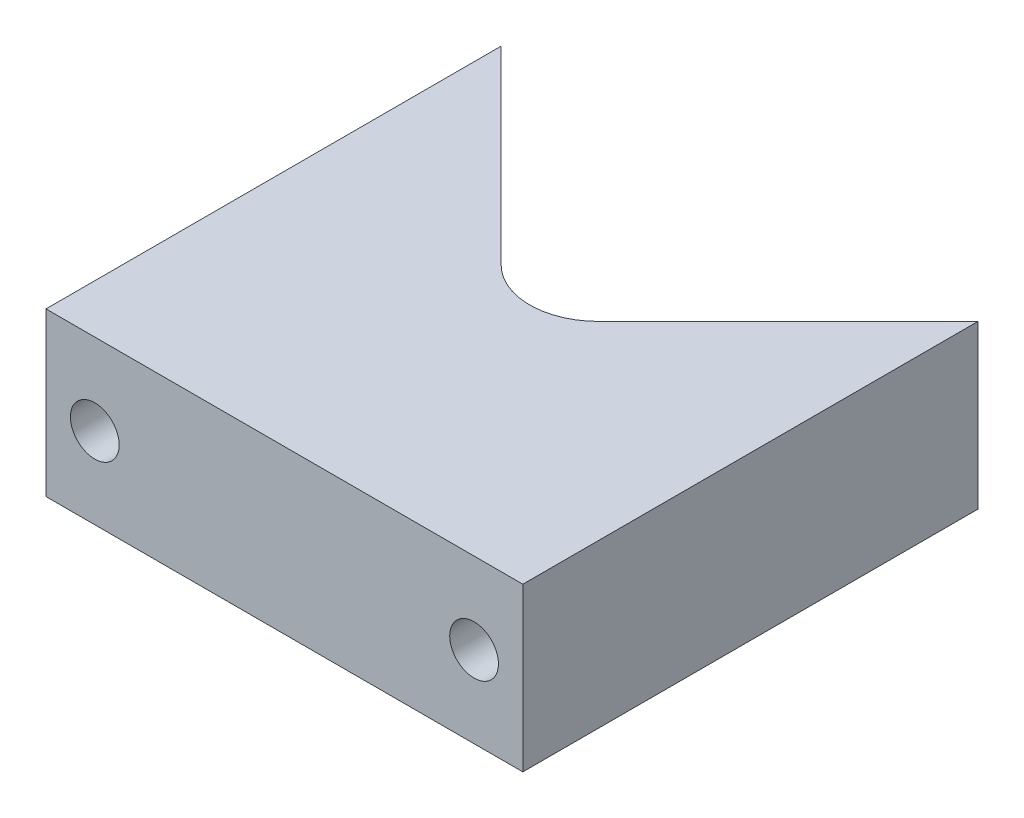
from build123d import *

# Parameters (mm, degrees)
BOSS_EXTRUDE1_DEPTH            = 15
SKETCH11_W                     = 2.25
SKETCH11_H                     = 12.7
M4_CLEARANCE_HOLE5_AT_2_COUNT  = 2
M4_CLEARANCE_HOLE5_AT_2_PITCH  = 35
SKETCH13_W                     = 3.75
SKETCH13_H                     = 29.3
F_6_0MM_DOWEL_HOLE1_AT_2_COUNT = 2
F_6_0MM_DOWEL_HOLE1_AT_2_PITCH = 35
FILLET1_R                      = 6.35


with BuildPart() as part:
    # Sketch1 → Boss-Extrude1 (new body)
    with BuildSketch(Plane(origin=(0, 0, 0), x_dir=(1, 0, 0), z_dir=(0, 1, 0))):
        Polygon((0, 0), (0, 42), (22, 20), (44, 42), (44, 0), align=None)
    extrude(amount=BOSS_EXTRUDE1_DEPTH)

    # Sketch11 → M4 Clearance Hole5 (revolve, cut)
    with BuildSketch(Plane(origin=(39.5, 7.5, -12.7), x_dir=(0, 1, 0), z_dir=(1, 0, 0))):
        with Locations((1.125, 6.35)):
            Rectangle(SKETCH11_W, SKETCH11_H)
    m4_clearance_hole5 = revolve(axis=Axis((39.5, 7.5, -19.05), (0, 0, 1)), mode=Mode.SUBTRACT)

    # M4 Clearance Hole5 at 2: M4 Clearance Hole5 ×2
    with Locations(*[(-i * M4_CLEARANCE_HOLE5_AT_2_PITCH, 0, 0) for i in range(1, M4_CLEARANCE_HOLE5_AT_2_COUNT)]):
        add(m4_clearance_hole5, mode=Mode.SUBTRACT)

    # Sketch13 → Ø6.0mm Dowel Hole1 (revolve, cut)
    with BuildSketch(Plane(origin=(39.5, 7.5, -12.7), x_dir=(0, -1, 0), z_dir=(1, 0, 0))):
        with Locations((1.875, 14.65)):
            Rectangle(SKETCH13_W, SKETCH13_H)
    f_6_0mm_dowel_hole1 = revolve(axis=Axis((39.5, 7.5, -6.35), (0, 0, -1)), mode=Mode.SUBTRACT)

    # Ø6.0mm Dowel Hole1 at 2: Ø6.0mm Dowel Hole1 ×2
    with Locations(*[(-i * F_6_0MM_DOWEL_HOLE1_AT_2_PITCH, 0, 0) for i in range(1, F_6_0MM_DOWEL_HOLE1_AT_2_COUNT)]):
        add(f_6_0mm_dowel_hole1, mode=Mode.SUBTRACT)

    # Fillet1
    fillet1_edges = [part.edges().sort_by_distance(p)[0] for p in [
        (22, 7.5, -20),
    ]]
    fillet(fillet1_edges, radius=FILLET1_R)


solid = part.part
